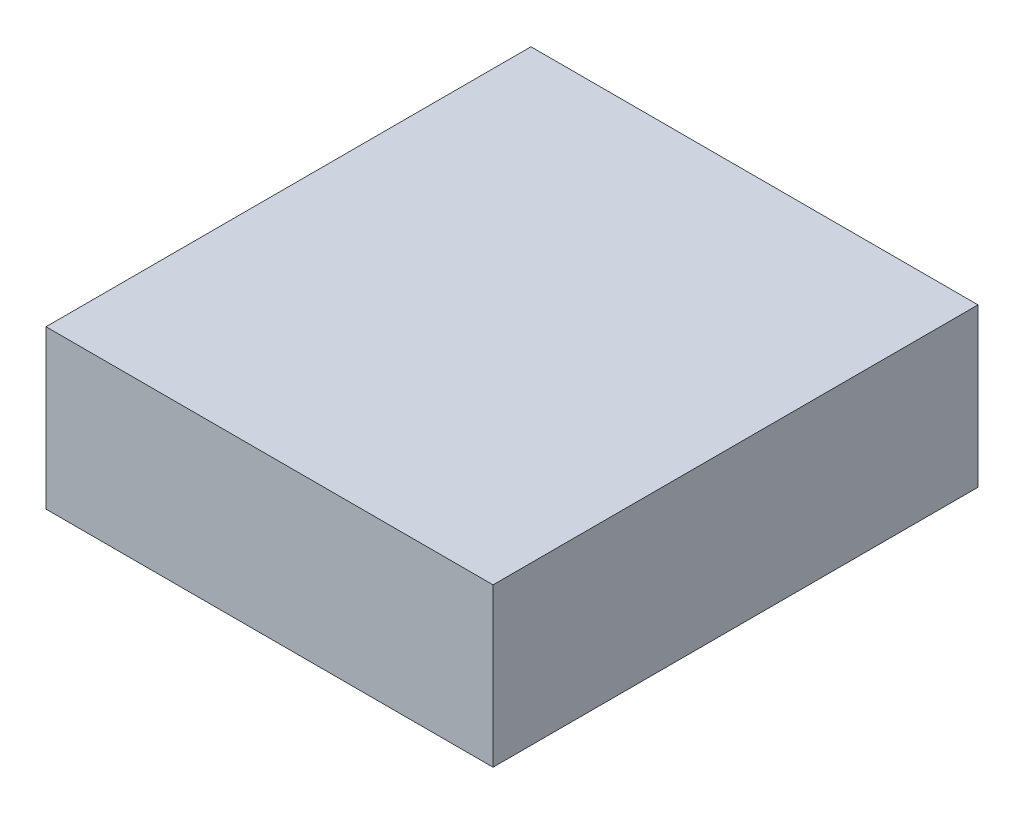
from build123d import *

# Parameters (mm, degrees)
SKETCH1_W           = 84.893810718
SKETCH1_H           = 92.092408704
BOSS_EXTRUDE1_DEPTH = 30


with BuildPart() as part:
    # Sketch1 → Boss-Extrude1 (new body)
    with BuildSketch(Plane(origin=(0, 0, 0), x_dir=(1, 0, 0), z_dir=(0, 1, 0))):
        Rectangle(SKETCH1_W, SKETCH1_H)
    extrude(amount=BOSS_EXTRUDE1_DEPTH)


solid = part.part
